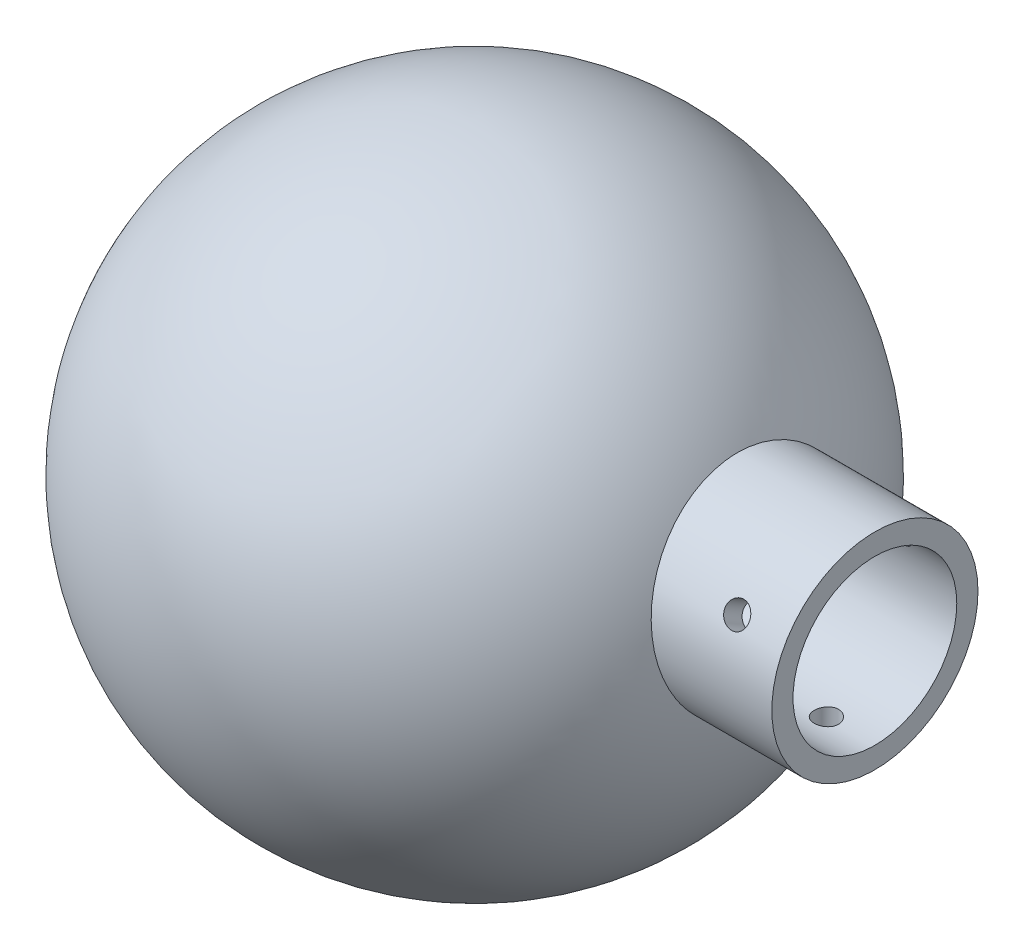
from build123d import *

# Parameters (mm, degrees)
SKETCH2_R                       = 21.59
SKETCH2_R_2                     = 17.145
BOSS_EXTRUDE1_DEPTH             = 83.82
BOSS_EXTRUDE1_DIRECTION_2_REACH = 111.985
SKETCH2_4_R                     = 17.145
CUT_EXTRUDE3_DEPTH              = 138.938
SKETCH4_R                       = 2.54
CUT_EXTRUDE4_DEPTH              = 138.938
CIRPATTERN1_COUNT               = 3


with BuildPart() as part:
    # Sketch1 → Revolve1 (revolve)
    with BuildSketch(Plane.XY):
        with BuildLine():
            Line((-63.5, 0), (-60.96, 0))
            ThreePointArc((-60.96, 0), (0, 60.96), (60.96, 0))
            Line((60.96, 0), (63.5, 0))
            ThreePointArc((63.5, 0), (0, 63.5), (-63.5, 0))
        make_face()
    revolve(axis=Axis((-63.5, 0, 0), (1, 0, 0)))

    # Sketch2 → Boss-Extrude1 (add)
    with BuildSketch(Plane(origin=(0, 0, 0), x_dir=(0, 0, -1), z_dir=(1, 0, 0))):
        with Locations((0, 10.0076)):
            Circle(SKETCH2_R)
        with Locations((0, 10.0076)):
            Circle(SKETCH2_R_2, mode=Mode.SUBTRACT)
    extrude(amount=BOSS_EXTRUDE1_DEPTH)

    # Sketch2 → Boss-Extrude1 direction 2 (add, up to next)
    with BuildSketch(Plane(origin=(0, 0, 0), x_dir=(0, 0, -1), z_dir=(1, 0, 0)), mode=Mode.PRIVATE) as boss_extrude1_direction_2_sk1:
        with Locations((0, 10.0076)):
            Circle(SKETCH2_R)
        with Locations((0, 10.0076)):
            Circle(SKETCH2_R_2, mode=Mode.SUBTRACT)
    boss_extrude1_direction_2_tool1 = extrude(boss_extrude1_direction_2_sk1.sketch, amount=-BOSS_EXTRUDE1_DIRECTION_2_REACH, mode=Mode.PRIVATE) - part.part
    add(boss_extrude1_direction_2_tool1.solids().sort_by_distance((0, 10.0076, 20.979343))[0])

    # Sketch2<4> → Cut-Extrude3 (cut)
    with BuildSketch(Plane(origin=(0, 0, 0), x_dir=(0, 0, -1), z_dir=(1, 0, 0))):
        with Locations((0, 10.0076)):
            Circle(SKETCH2_4_R)
    extrude(amount=CUT_EXTRUDE3_DEPTH, mode=Mode.SUBTRACT)

    # Sketch4 → Cut-Extrude4 (cut)
    with BuildSketch(Plane(origin=(0, 0, 0), x_dir=(1, 0, 0), z_dir=(0, 1, 0))):
        with Locations((73.66, 0)):
            Circle(SKETCH4_R)
    cut_extrude4 = extrude(amount=-CUT_EXTRUDE4_DEPTH, mode=Mode.SUBTRACT)

    # CirPattern1: Cut-Extrude4 ×3 about axis
    cirpattern1_axis = Axis((-63.502, 10.0076, 0), (1, 0, 0))
    for i in range(1, CIRPATTERN1_COUNT):
        add(cut_extrude4.rotate(cirpattern1_axis, i * 360 / CIRPATTERN1_COUNT), mode=Mode.SUBTRACT)


solid = part.part
